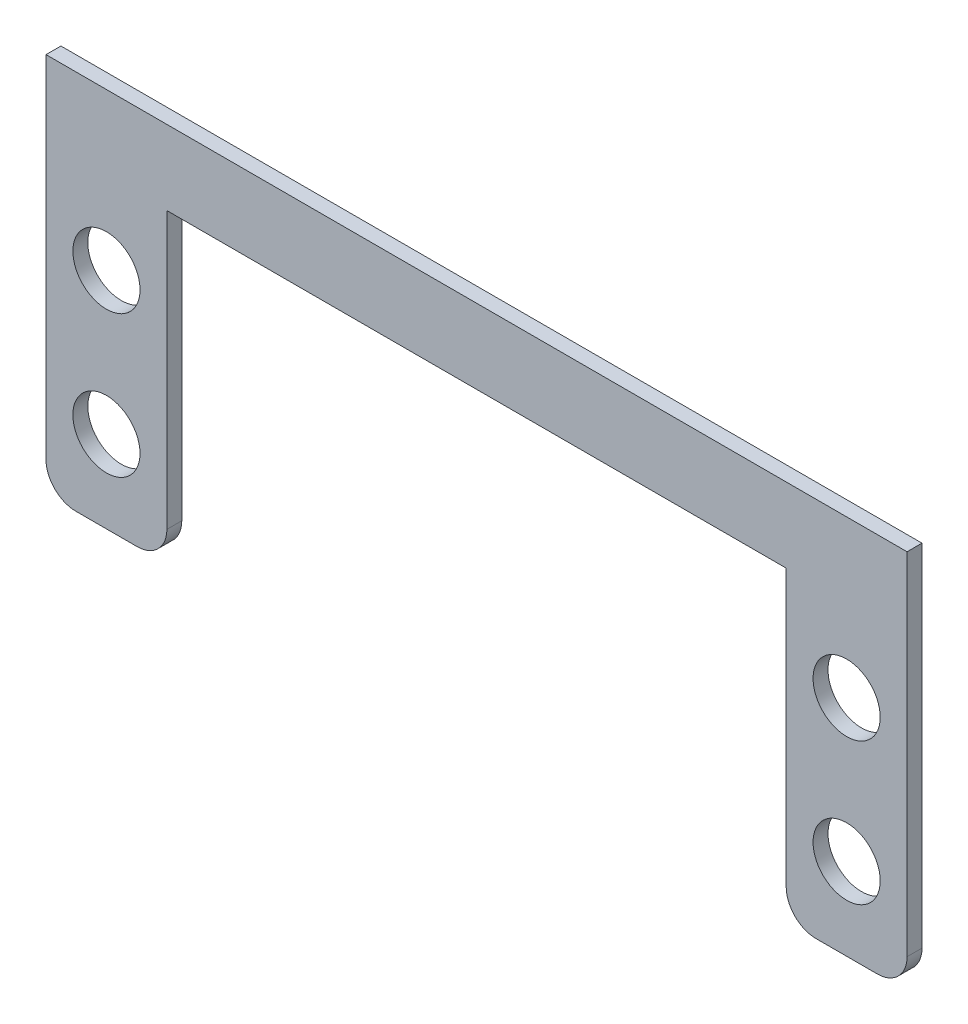
from build123d import *

# Parameters (mm, degrees)
SKETCH1_R           = 2.25
BOSS_EXTRUDE1_DEPTH = 1


with BuildPart() as part:
    # Sketch1 → Boss-Extrude1 (new body)
    with BuildSketch(Plane.XY):
        with BuildLine():
            Line((-43.5, -20.5), (-47.6, -20.5))
            ThreePointArc((-47.6, -20.5), (-49.014213562, -19.914213562), (-49.6, -18.5))
            Line((-49.6, -18.5), (-49.6, 5))
            Line((-49.6, 5), (8.1, 5))
            Line((8.1, 5), (8.1, -18.5))
            ThreePointArc((8.1, -18.5), (7.514213562, -19.914213562), (6.1, -20.5))
            Line((6.1, -20.5), (2, -20.5))
            ThreePointArc((2, -20.5), (0.585786438, -19.914213562), (0, -18.5))
            Line((0, -18.5), (0, 0))
            Line((0, 0), (-41.5, 0))
            Line((-41.5, 0), (-41.5, -18.5))
            ThreePointArc((-41.5, -18.5), (-42.085786438, -19.914213562), (-43.5, -20.5))
        make_face()
        with Locations((-45.55, -5.5)):
            Circle(SKETCH1_R, mode=Mode.SUBTRACT)
        with Locations((-45.55, -15)):
            Circle(SKETCH1_R, mode=Mode.SUBTRACT)
        with Locations((4.05, -5.5)):
            Circle(SKETCH1_R, mode=Mode.SUBTRACT)
        with Locations((4.05, -15)):
            Circle(SKETCH1_R, mode=Mode.SUBTRACT)
    extrude(amount=BOSS_EXTRUDE1_DEPTH)


solid = part.part
